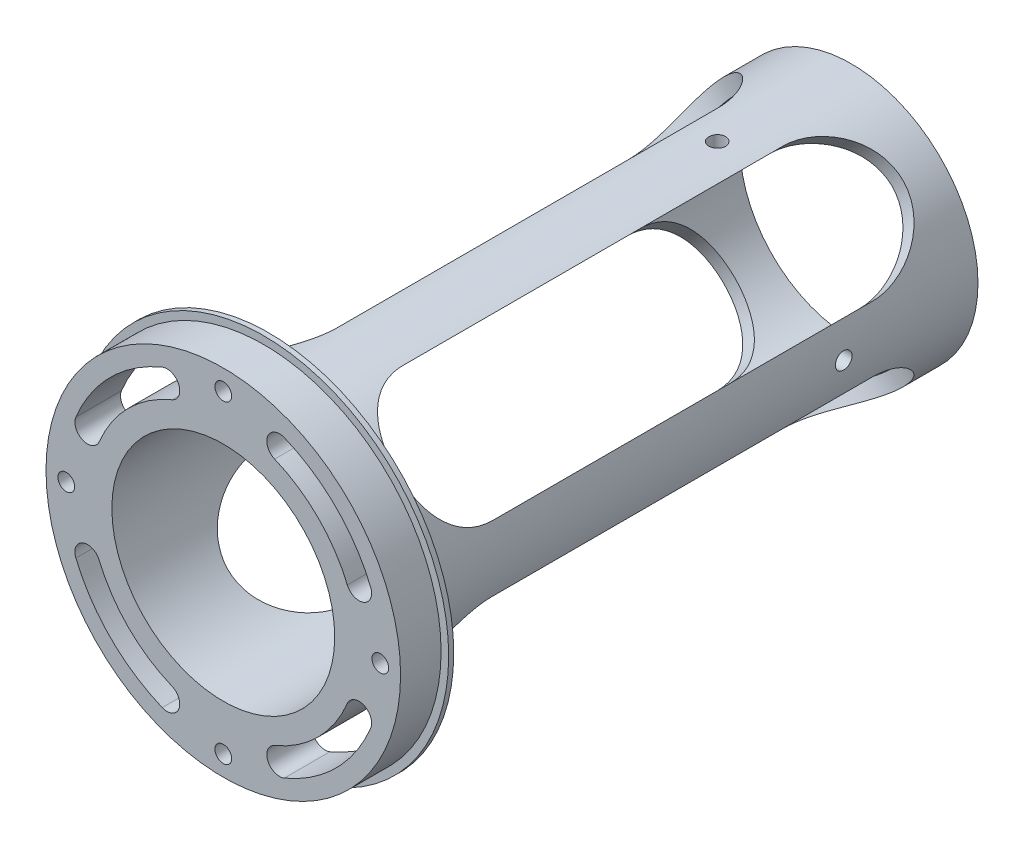
from build123d import *

# Parameters (mm, degrees)
EXTRUDE_START            = 8
SKETCH_5_R               = 35
SKETCH_5_R_2             = 22
EXTRUDE_1_DEPTH          = 8
HOLE_WIZARD_M4_3_D       = 3.3
SKETCH_9_W               = 1.65
SKETCH_9_H               = 36.5
CUT_EXTRUDE_1_DEPTH      = 127.053560136
CUT_EXTRUDE_2_DEPTH      = 127.966531114
PATTERN_CIRCULAR_1_COUNT = 4


with BuildPart() as part:
    # 草图1 → 旋转1 (revolve)
    with BuildSketch(Plane(origin=(0, 0, 0), x_dir=(1, 0, 0), z_dir=(0, 1, 0))):
        Polygon((36.5, 0), (36.5, 1), (25, 1), (25, 116), (22, 116), (22, 0), align=None)
    revolve(axis=Axis((0, 0, 0), (0, 0, -1)))

    # 草图5 → 凸台-拉伸1 (add)
    with BuildSketch(Plane.XY.offset(EXTRUDE_START)):
        Circle(SKETCH_5_R)
        Circle(SKETCH_5_R_2, mode=Mode.SUBTRACT)
    extrude(amount=-EXTRUDE_1_DEPTH)

    # M4 螺纹孔3 (through all)
    with Locations(Plane(origin=(0, 0, 8), x_dir=(-1, 0, 0), z_dir=(0, 0, 1))):
        with Locations((31, 0), (0, 31), (-31, 0), (0, -31)):
            Hole(HOLE_WIZARD_M4_3_D / 2)

    # 草图9 → M4 螺纹孔2 (revolve, cut)
    with BuildSketch(Plane(origin=(0, 0, -89.5), x_dir=(0, 0, -1), z_dir=(1, 0, 0))):
        with Locations((0.825, 18.25)):
            Rectangle(SKETCH_9_W, SKETCH_9_H)
    hole_wizard_m4_2 = revolve(axis=Axis((0, -6.35, -89.5), (0, 1, 0)), mode=Mode.SUBTRACT)

    # 草图2 → 切除-拉伸1 (cut, through all)
    with BuildSketch(Plane(origin=(0, 0, -1), x_dir=(-1, 0, 0), z_dir=(0, 0, -1))):
        with BuildLine():
            ThreePointArc((-12.05452812, 29.102205274), (-22.273863607, 22.273863607), (-29.102205274, 12.05452812))
            ThreePointArc((-29.102205274, 12.05452812), (-27.749215024, 8.788120707), (-24.482807612, 10.141110958))
            ThreePointArc((-24.482807612, 10.141110958), (-18.738329701, 18.738329701), (-10.141110958, 24.482807612))
            ThreePointArc((-10.141110958, 24.482807612), (-8.788120707, 27.749215024), (-12.05452812, 29.102205274))
        make_face()
        with BuildLine():
            ThreePointArc((29.102205274, 12.05452812), (22.273863607, 22.273863607), (12.05452812, 29.102205274))
            ThreePointArc((12.05452812, 29.102205274), (8.788120707, 27.749215024), (10.141110958, 24.482807612))
            ThreePointArc((10.141110958, 24.482807612), (18.738329701, 18.738329701), (24.482807612, 10.141110958))
            ThreePointArc((24.482807612, 10.141110958), (27.749215024, 8.788120707), (29.102205274, 12.05452812))
        make_face()
        with BuildLine():
            ThreePointArc((12.05452812, -29.102205274), (22.273863607, -22.273863607), (29.102205274, -12.05452812))
            ThreePointArc((29.102205274, -12.05452812), (27.749215024, -8.788120707), (24.482807612, -10.141110958))
            ThreePointArc((24.482807612, -10.141110958), (18.738329701, -18.738329701), (10.141110958, -24.482807612))
            ThreePointArc((10.141110958, -24.482807612), (8.788120707, -27.749215024), (12.05452812, -29.102205274))
        make_face()
        with BuildLine():
            ThreePointArc((-29.102205274, -12.05452812), (-22.273863607, -22.273863607), (-12.05452812, -29.102205274))
            ThreePointArc((-12.05452812, -29.102205274), (-8.788120707, -27.749215024), (-10.141110958, -24.482807612))
            ThreePointArc((-10.141110958, -24.482807612), (-18.738329701, -18.738329701), (-24.482807612, -10.141110958))
            ThreePointArc((-24.482807612, -10.141110958), (-27.749215024, -8.788120707), (-29.102205274, -12.05452812))
        make_face()
    extrude(amount=-CUT_EXTRUDE_1_DEPTH, mode=Mode.SUBTRACT)

    # 草图10 → 切除-拉伸2 (cut, through all)
    with BuildSketch(Plane(origin=(0, 0, 0), x_dir=(0, 0, -1), z_dir=(0.7071067811865488, 0.7071067811865464, 0))):
        with BuildLine():
            Line((21, 12.5), (96, 12.5))
            ThreePointArc((96, 12.5), (108.5, 0), (96, -12.5))
            Line((96, -12.5), (21, -12.5))
            ThreePointArc((21, -12.5), (8.5, 0), (21, 12.5))
        make_face()
    cut_extrude_2 = extrude(amount=CUT_EXTRUDE_2_DEPTH, mode=Mode.SUBTRACT)

    # 阵列(圆周)1: M4 螺纹孔2, 切除-拉伸2 ×4 about axis
    pattern_circular_1_axis = Axis((0, 0, 0), (0, 0, 1))
    add([hole_wizard_m4_2.rotate(pattern_circular_1_axis, i * 360 / PATTERN_CIRCULAR_1_COUNT) for i in range(1, PATTERN_CIRCULAR_1_COUNT)], mode=Mode.SUBTRACT)
    add([cut_extrude_2.rotate(pattern_circular_1_axis, i * 360 / PATTERN_CIRCULAR_1_COUNT) for i in range(1, PATTERN_CIRCULAR_1_COUNT)], mode=Mode.SUBTRACT)


solid = part.part
